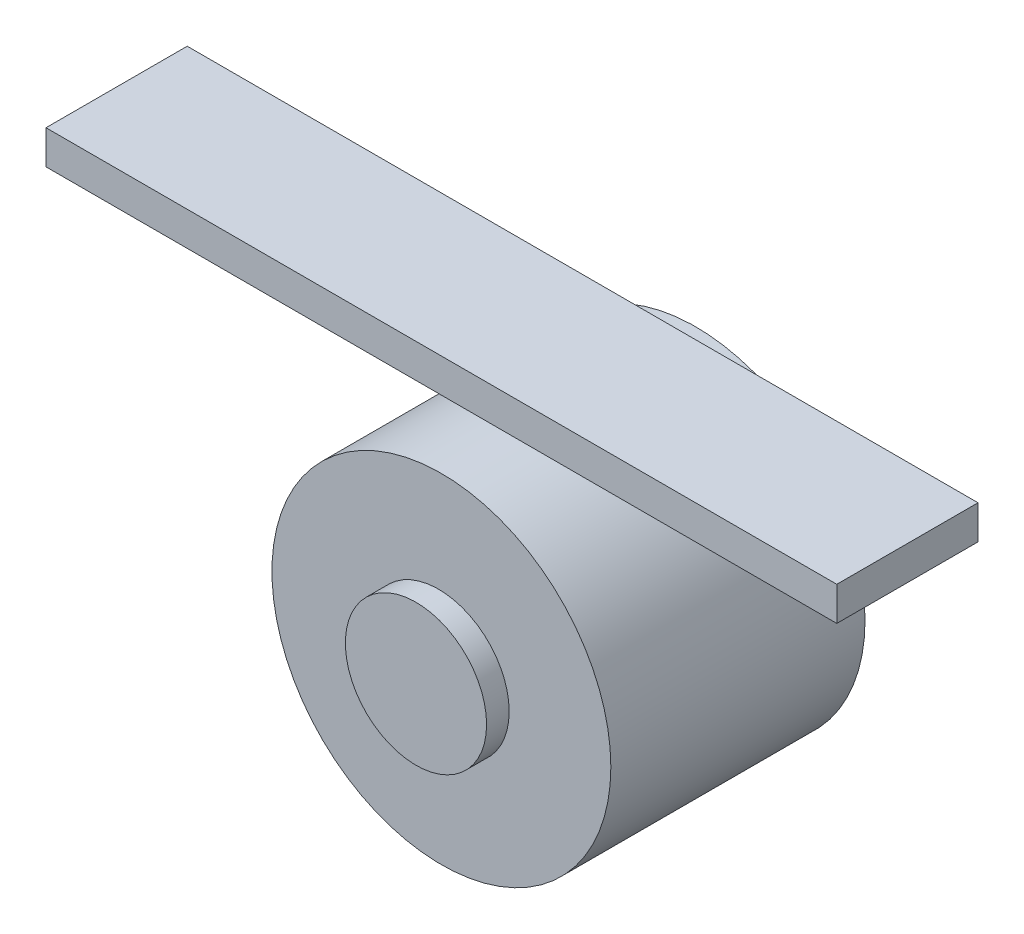
from build123d import *

# Parameters (mm, degrees)
ACTIVE_START                      = -4.5
SKETCH_1_R                        = 6
ACTIVE_BUZZER_DIA_12_X_9_MM_DEPTH = 9
SOUND_START                       = 4.6
SKETCH_2_R                        = 2.5
SOUND_OUTLET_MARKER_DEPTH         = 0.8
BUZZER_START                      = -0.5
SKETCH_3_W                        = 28
SKETCH_3_H                        = 1.2
BUZZER_LABEL_PLATE_BUZZER_DEPTH   = 5


with BuildPart() as part:
    # 草图1 → active buzzer - dia 12 x 9 mm (new body)
    with BuildSketch(Plane.XY.offset(ACTIVE_START)):
        Circle(SKETCH_1_R)
    extrude(amount=ACTIVE_BUZZER_DIA_12_X_9_MM_DEPTH)


with BuildPart() as body_2:
    # 草图2 → sound outlet marker (new body)
    with BuildSketch(Plane.XY.offset(SOUND_START)):
        Circle(SKETCH_2_R)
    extrude(amount=SOUND_OUTLET_MARKER_DEPTH)


with BuildPart() as body_3:
    # 草图3 → buzzer label plate - BUZZER (new body)
    with BuildSketch(Plane.XY.offset(BUZZER_START)):
        with Locations((0, 9)):
            Rectangle(SKETCH_3_W, SKETCH_3_H)
    extrude(amount=BUZZER_LABEL_PLATE_BUZZER_DEPTH)


solid = Compound([part.part, body_2.part, body_3.part])
